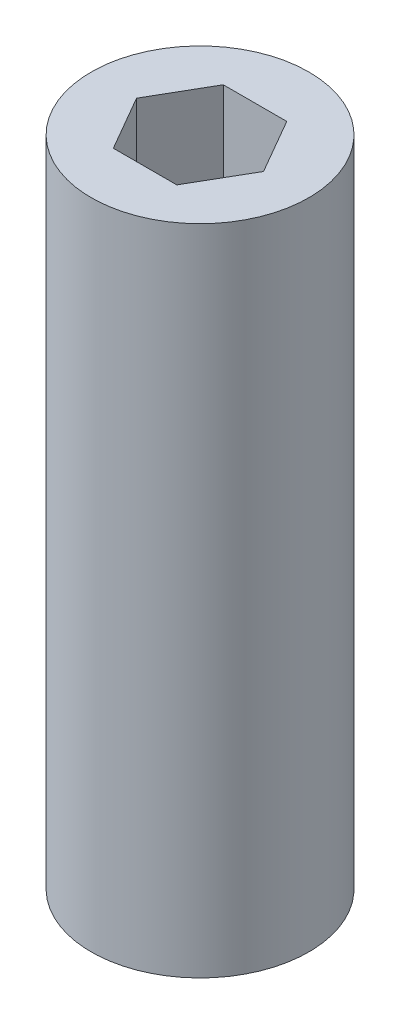
from build123d import *

# Parameters (mm, degrees)
SKETCH1_R           = 12.7
BOSS_EXTRUDE1_DEPTH = 76.2
CUT_EXTRUDE1_DEPTH  = 79.288057838


with BuildPart() as part:
    # Sketch1 → Boss-Extrude1 (new body)
    with BuildSketch(Plane(origin=(0, 0, 0), x_dir=(1, 0, 0), z_dir=(0, 1, 0))):
        with Locations(Location((0, 0, 0), (0, 0, 90))):
            Circle(SKETCH1_R)
    extrude(amount=BOSS_EXTRUDE1_DEPTH)

    # Sketch5 → Cut-Extrude1 (cut, through all)
    with BuildSketch(Plane(origin=(0, 0, 0), x_dir=(-1, 0, 0), z_dir=(0, -1, 0))):
        Polygon((-7.405671903, 0), (-3.702835951, -6.4135), (3.702835951, -6.4135), (7.405671903, 0), (3.702835951, 6.4135), (-3.702835951, 6.4135), align=None)
    extrude(amount=-CUT_EXTRUDE1_DEPTH, mode=Mode.SUBTRACT)


solid = part.part
